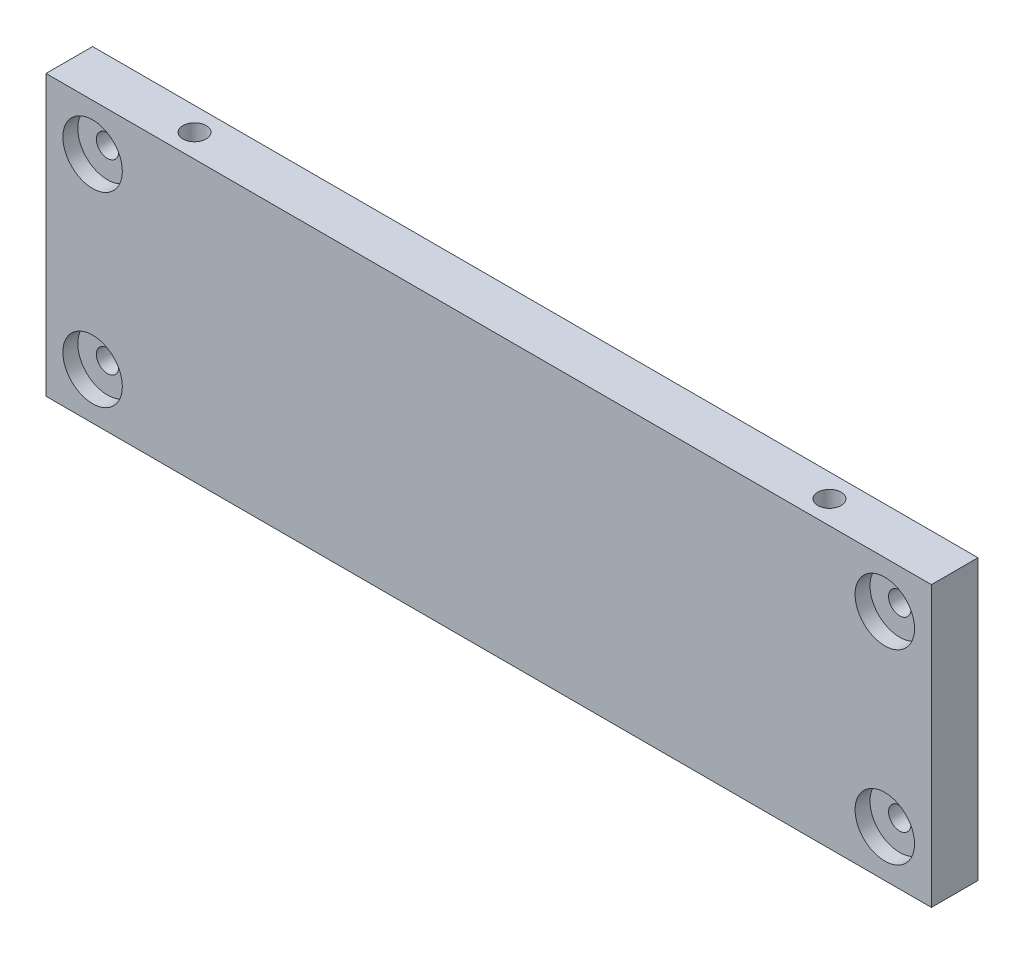
from build123d import *

# Parameters (mm, degrees)
SKETCH1_W                                        = 95
SKETCH1_H                                        = 30
BOSS_EXTRUDE1_DEPTH                              = 5
CBORE_FOR_M2_HEX_HEAD_MACHINE_SCREW1_D           = 2.4
CBORE_FOR_M2_HEX_HEAD_MACHINE_SCREW1_CBORE_D     = 6.38
CBORE_FOR_M2_HEX_HEAD_MACHINE_SCREW1_CBORE_DEPTH = 1.6
M3X0_5_TAPPED_HOLE1_D                            = 2.5
M3X0_5_TAPPED_HOLE1_DEPTH                        = 3
M3X0_5_TAPPED_HOLE1_TIP                          = 0.751075774


with BuildPart() as part:
    # Sketch1 → Boss-Extrude1 (new body)
    with BuildSketch(Plane.XY):
        Rectangle(SKETCH1_W, SKETCH1_H)
    extrude(amount=BOSS_EXTRUDE1_DEPTH)

    # CBORE for M2 Hex Head Machine Screw1 (through all)
    with Locations(Plane.XY.offset(5)):
        with Locations((-42.5, 10), (-42.5, -10), (42.5, -10), (42.5, 10)):
            CounterBoreHole(CBORE_FOR_M2_HEX_HEAD_MACHINE_SCREW1_D / 2, CBORE_FOR_M2_HEX_HEAD_MACHINE_SCREW1_CBORE_D / 2, CBORE_FOR_M2_HEX_HEAD_MACHINE_SCREW1_CBORE_DEPTH)

    # M3x0.5 Tapped Hole1
    with Locations(Plane(origin=(0, 15, 0), x_dir=(1, 0, 0), z_dir=(0, 1, 0))):
        with Locations((34.061922087, -2.5), (-34.061922087, -2.5)):
            Hole(M3X0_5_TAPPED_HOLE1_D / 2, depth=M3X0_5_TAPPED_HOLE1_DEPTH)
            with Locations((0, 0, -(M3X0_5_TAPPED_HOLE1_DEPTH + M3X0_5_TAPPED_HOLE1_TIP / 2))):  # 118° drill point
                Cone(0, M3X0_5_TAPPED_HOLE1_D / 2, M3X0_5_TAPPED_HOLE1_TIP, mode=Mode.SUBTRACT)


solid = part.part
